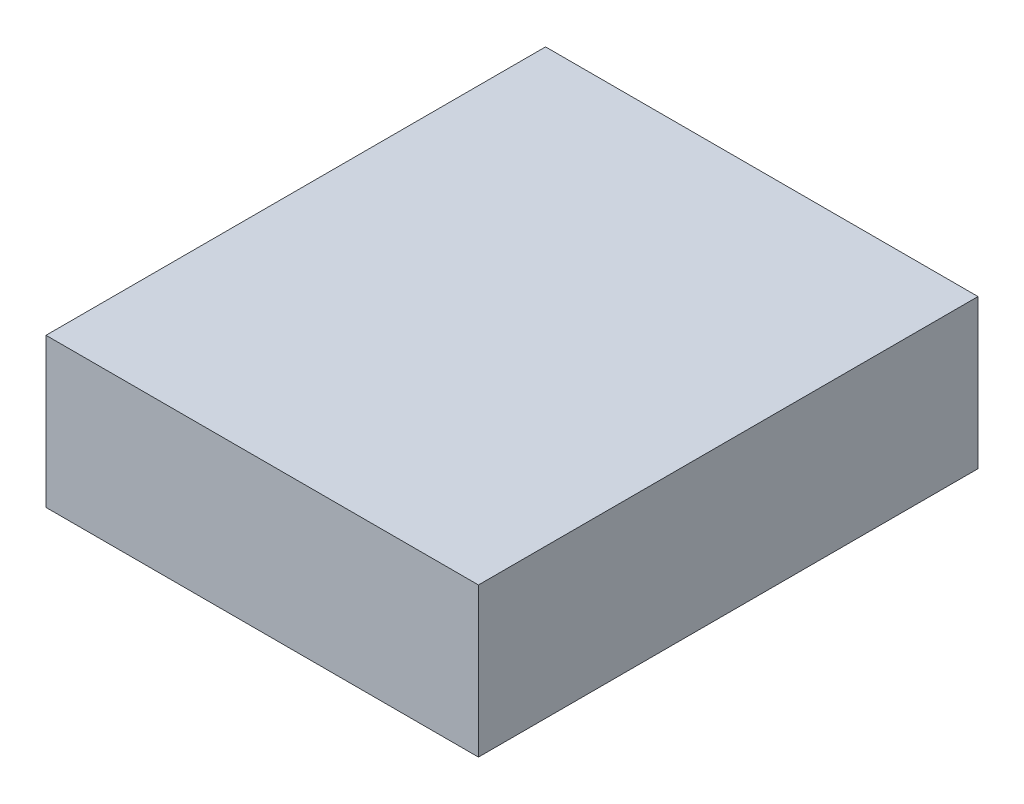
from build123d import *

# Parameters (mm, degrees)
SKETCH1_W           = 58
SKETCH1_H           = 67
BOSS_EXTRUDE1_DEPTH = 20


with BuildPart() as part:
    # Sketch1 → Boss-Extrude1 (new body)
    with BuildSketch(Plane(origin=(0, 0, 0), x_dir=(1, 0, 0), z_dir=(0, 1, 0))):
        with Locations((-90.572916667, 13.625)):
            Rectangle(SKETCH1_W, SKETCH1_H)
    extrude(amount=BOSS_EXTRUDE1_DEPTH)


solid = part.part
